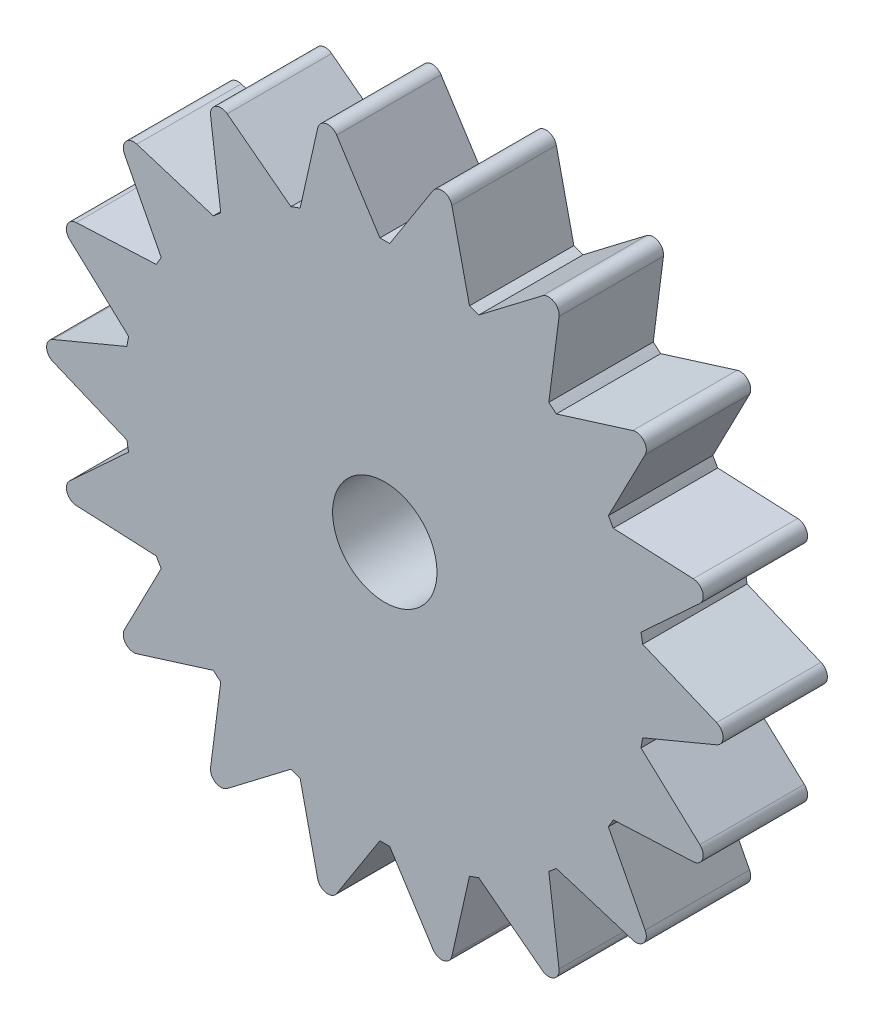
from build123d import *

# Parameters (mm, degrees)
EXTRUDE_1_DEPTH     = 20
SKETCH_2_R          = 10
CUT_EXTRUDE_1_DEPTH = 20


with BuildPart() as part:
    # 草圖1 → 填料-伸長1 (new body)
    with BuildSketch(Plane.XY):
        with BuildLine():
            Line((-63.548984366, 1.845434638), (-49.394355, 7.7587173))
            ThreePointArc((-49.394355, 7.7587173), (-49.240387651, 8.682408883), (-49.069148505, 9.603054983))
            Line((-49.069148505, 9.603054983), (-60.347687486, 20.00089143))
            ThreePointArc((-60.347687486, 20.00089143), (-60.871436558, 22.155391024), (-59.085335848, 23.469174052))
            Line((-59.085335848, 23.469174052), (-43.761873299, 24.18467377))
            ThreePointArc((-43.761873299, 24.18467377), (-43.301270189, 25), (-42.825478517, 25.806557109))
            Line((-42.825478517, 25.806557109), (-49.867568859, 39.434814809))
            ThreePointArc((-49.867568859, 39.434814809), (-49.622849737, 41.638514912), (-47.49512382, 42.262184708))
            Line((-47.49512382, 42.262184708), (-32.851063821, 37.693601656))
            ThreePointArc((-32.851063821, 37.693601656), (-32.139380484, 38.302222156), (-31.416423783, 38.897407583))
            Line((-31.416423783, 38.897407583), (-33.37268546, 54.112317527))
            ThreePointArc((-33.37268546, 54.112317527), (-32.389014882, 56.099419383), (-30.176298906, 55.957752164))
            Line((-30.176298906, 55.957752164), (-17.977931217, 46.656124884))
            ThreePointArc((-17.977931217, 46.656124884), (-17.101007166, 46.984631039), (-16.218084684, 47.296656639))
            Line((-16.218084684, 47.296656639), (-12.852563667, 62.263076138))
            ThreePointArc((-12.852563667, 62.263076138), (-11.248586821, 63.793905936), (-9.217766989, 62.903988861))
            Line((-9.217766989, 62.903988861), (-0.936394782, 49.991230879))
            ThreePointArc((-0.936394782, 49.991230879), (0, 50), (0.936394782, 49.991230879))
            Line((0.936394782, 49.991230879), (9.217766989, 62.903988861))
            ThreePointArc((9.217766989, 62.903988861), (11.248586821, 63.793905936), (12.852563667, 62.263076138))
            Line((12.852563667, 62.263076138), (16.218084684, 47.296656639))
            ThreePointArc((16.218084684, 47.296656639), (17.101007166, 46.984631039), (17.977931217, 46.656124884))
            Line((17.977931217, 46.656124884), (30.176298906, 55.957752164))
            ThreePointArc((30.176298906, 55.957752164), (32.389014882, 56.099419383), (33.37268546, 54.112317527))
            Line((33.37268546, 54.112317527), (31.416423783, 38.897407583))
            ThreePointArc((31.416423783, 38.897407583), (32.139380484, 38.302222156), (32.851063821, 37.693601656))
            Line((32.851063821, 37.693601656), (47.49512382, 42.262184708))
            ThreePointArc((47.49512382, 42.262184708), (49.622849737, 41.638514912), (49.867568859, 39.434814809))
            Line((49.867568859, 39.434814809), (42.825478517, 25.806557109))
            ThreePointArc((42.825478517, 25.806557109), (43.301270189, 25), (43.761873299, 24.18467377))
            Line((43.761873299, 24.18467377), (59.085335848, 23.469174052))
            ThreePointArc((59.085335848, 23.469174052), (60.871436558, 22.155391024), (60.347687486, 20.00089143))
            Line((60.347687486, 20.00089143), (49.069148505, 9.603054983))
            ThreePointArc((49.069148505, 9.603054983), (49.240387651, 8.682408883), (49.394355, 7.7587173))
            Line((49.394355, 7.7587173), (63.548984366, 1.845434638))
            ThreePointArc((63.548984366, 1.845434638), (64.778029764, 0), (63.548984366, -1.845434638))
            Line((63.548984366, -1.845434638), (49.394355, -7.7587173))
            ThreePointArc((49.394355, -7.7587173), (49.240387651, -8.682408883), (49.069148505, -9.603054983))
            Line((49.069148505, -9.603054983), (60.347687486, -20.00089143))
            ThreePointArc((60.347687486, -20.00089143), (60.871436558, -22.155391024), (59.085335848, -23.469174052))
            Line((59.085335848, -23.469174052), (43.761873299, -24.18467377))
            ThreePointArc((43.761873299, -24.18467377), (43.301270189, -25), (42.825478517, -25.806557109))
            Line((42.825478517, -25.806557109), (49.867568859, -39.434814809))
            ThreePointArc((49.867568859, -39.434814809), (49.622849737, -41.638514912), (47.49512382, -42.262184708))
            Line((47.49512382, -42.262184708), (32.851063821, -37.693601656))
            ThreePointArc((32.851063821, -37.693601656), (32.139380484, -38.302222156), (31.416423783, -38.897407583))
            Line((31.416423783, -38.897407583), (33.37268546, -54.112317527))
            ThreePointArc((33.37268546, -54.112317527), (32.389014882, -56.099419383), (30.176298906, -55.957752164))
            Line((30.176298906, -55.957752164), (17.977931217, -46.656124884))
            ThreePointArc((17.977931217, -46.656124884), (17.101007166, -46.984631039), (16.218084684, -47.296656639))
            Line((16.218084684, -47.296656639), (12.852563667, -62.263076138))
            ThreePointArc((12.852563667, -62.263076138), (11.248586821, -63.793905936), (9.217766989, -62.903988861))
            Line((9.217766989, -62.903988861), (0.936394782, -49.991230879))
            ThreePointArc((0.936394782, -49.991230879), (0, -50), (-0.936394782, -49.991230879))
            Line((-0.936394782, -49.991230879), (-9.217766989, -62.903988861))
            ThreePointArc((-9.217766989, -62.903988861), (-11.248586821, -63.793905936), (-12.852563667, -62.263076138))
            Line((-12.852563667, -62.263076138), (-16.218084684, -47.296656639))
            ThreePointArc((-16.218084684, -47.296656639), (-17.101007166, -46.984631039), (-17.977931217, -46.656124884))
            Line((-17.977931217, -46.656124884), (-30.176298906, -55.957752164))
            ThreePointArc((-30.176298906, -55.957752164), (-32.389014882, -56.099419383), (-33.37268546, -54.112317527))
            Line((-33.37268546, -54.112317527), (-31.416423783, -38.897407583))
            ThreePointArc((-31.416423783, -38.897407583), (-32.139380484, -38.302222156), (-32.851063821, -37.693601656))
            Line((-32.851063821, -37.693601656), (-47.49512382, -42.262184708))
            ThreePointArc((-47.49512382, -42.262184708), (-49.622849737, -41.638514912), (-49.867568859, -39.434814809))
            Line((-49.867568859, -39.434814809), (-42.825478517, -25.806557109))
            ThreePointArc((-42.825478517, -25.806557109), (-43.301270189, -25), (-43.761873299, -24.18467377))
            Line((-43.761873299, -24.18467377), (-59.085335848, -23.469174052))
            ThreePointArc((-59.085335848, -23.469174052), (-60.871436558, -22.155391024), (-60.347687486, -20.00089143))
            Line((-60.347687486, -20.00089143), (-49.069148505, -9.603054983))
            ThreePointArc((-49.069148505, -9.603054983), (-49.240387651, -8.682408883), (-49.394355, -7.7587173))
            Line((-49.394355, -7.7587173), (-63.548984366, -1.845434638))
            ThreePointArc((-63.548984366, -1.845434638), (-64.778029764, 0), (-63.548984366, 1.845434638))
        make_face()
    extrude(amount=EXTRUDE_1_DEPTH)

    # 草圖2 → 除料-伸長1 (cut)
    with BuildSketch(Plane.XY.offset(20)):
        Circle(SKETCH_2_R)
    extrude(amount=-CUT_EXTRUDE_1_DEPTH, mode=Mode.SUBTRACT)


solid = part.part
